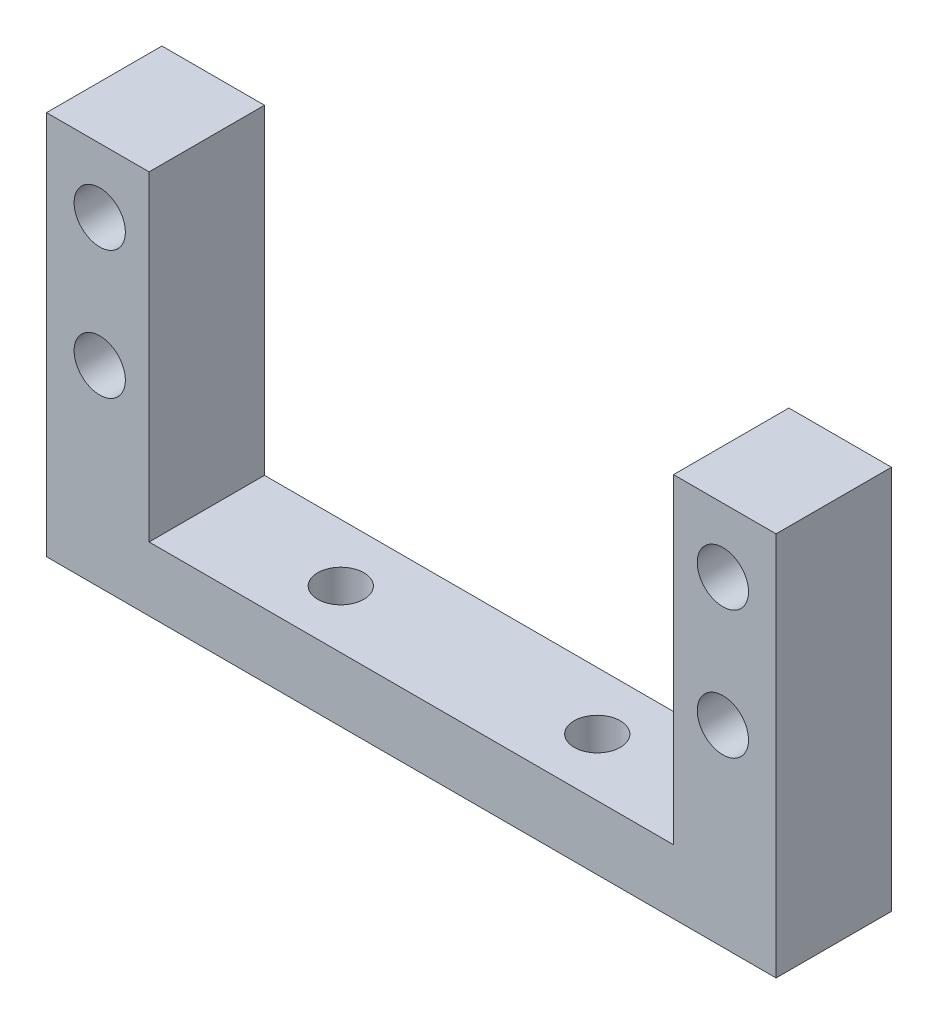
from build123d import *

# Parameters (mm, degrees)
ESQUISSE1_W             = 40.9
ESQUISSE1_H             = 5
ESQUISSE1_W_2           = 8
ESQUISSE1_H_2           = 30
ESQUISSE1_R             = 2
BOSS_EXTRU_1_DEPTH      = 9
ESQUISSE2_R             = 1.8
ENL_V_MAT_EXTRU_1_DEPTH = 9


with BuildPart() as part:
    # Esquisse1 → Boss.-Extru.1 (new body)
    # profile 1 of 3: a face of its own
    with BuildSketch(Plane.XY):
        with Locations((28.45, 2.5)):
            Rectangle(ESQUISSE1_W, ESQUISSE1_H)
    # profile 2 of 3: a face of its own
    with BuildSketch(Plane.XY):
        with Locations((4, 15)):
            Rectangle(ESQUISSE1_W_2, ESQUISSE1_H_2)
        with Locations((4.15, 15)):
            Circle(ESQUISSE1_R, mode=Mode.SUBTRACT)
        with Locations((4.15, 25)):
            Circle(ESQUISSE1_R, mode=Mode.SUBTRACT)
    # profile 3 of 3: a face of its own
    with BuildSketch(Plane.XY):
        Polygon((48.9, 5), (48.9, 0), (56.9, 0), (56.9, 30), (48.9, 30), align=None)
        with Locations((52.75, 15)):
            Circle(ESQUISSE1_R, mode=Mode.SUBTRACT)
        with Locations((52.75, 25)):
            Circle(ESQUISSE1_R, mode=Mode.SUBTRACT)
    extrude(amount=BOSS_EXTRU_1_DEPTH)

    # Esquisse2 → Enlèv. mat.-Extru.1 (cut)
    with BuildSketch(Plane.XZ):
        with Locations((18.45, 4.5)):
            Circle(ESQUISSE2_R)
        with Locations((38.45, 4.5)):
            Circle(ESQUISSE2_R)
    extrude(amount=-ENL_V_MAT_EXTRU_1_DEPTH, mode=Mode.SUBTRACT)


solid = part.part
